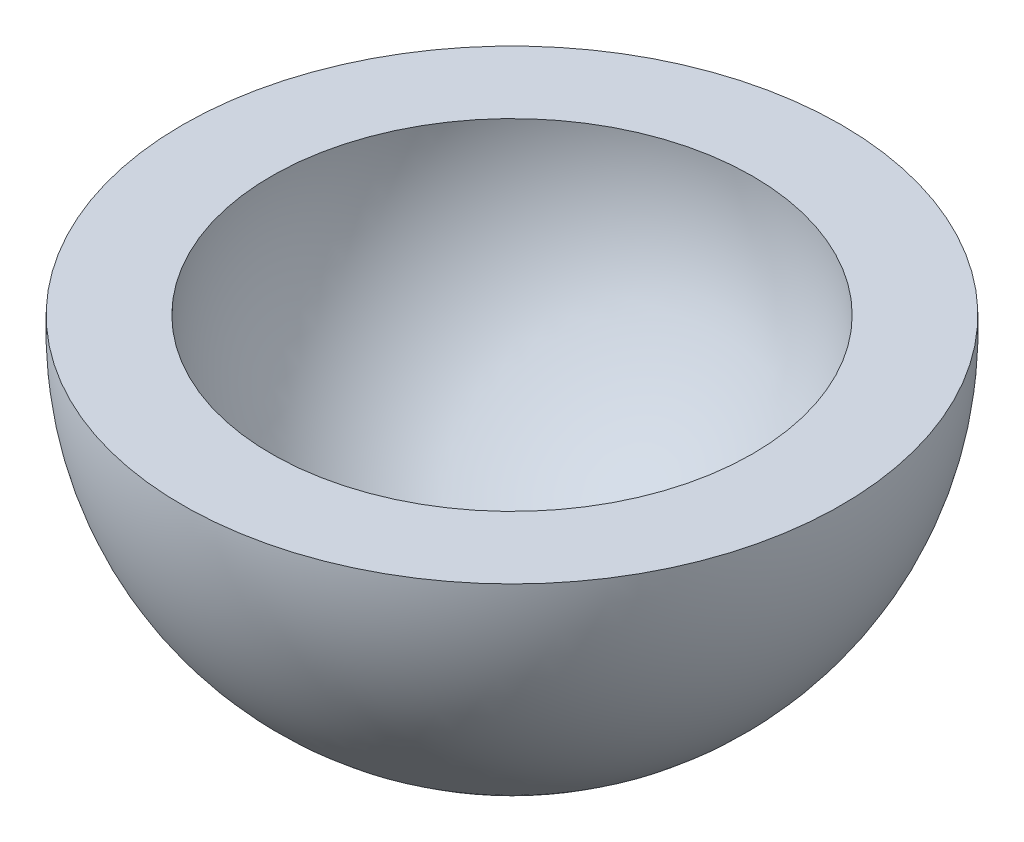
from build123d import *


with BuildPart() as part:
    # Sketch1 → Revolve-Thin1 (revolve)
    with BuildSketch(Plane.XY):
        with BuildLine():
            ThreePointArc((0, -200), (141.421356237, -141.421356237), (200, 0))
            Line((200, 0), (250, 0))
            ThreePointArc((250, 0), (176.776695297, -176.776695297), (0, -250))
            Line((0, -250), (0, -260))
            ThreePointArc((0, -260), (187.349939952, -180.277563773), (259.807621135, 10))
            Line((259.807621135, 10), (189.73665961, 10))
            ThreePointArc((189.73665961, 10), (137.840487521, -130.766968306), (0, -190))
            Line((0, -190), (0, -200))
        make_face()
    revolve(axis=Axis((0, -250, 0), (0, 1, 0)))


solid = part.part
